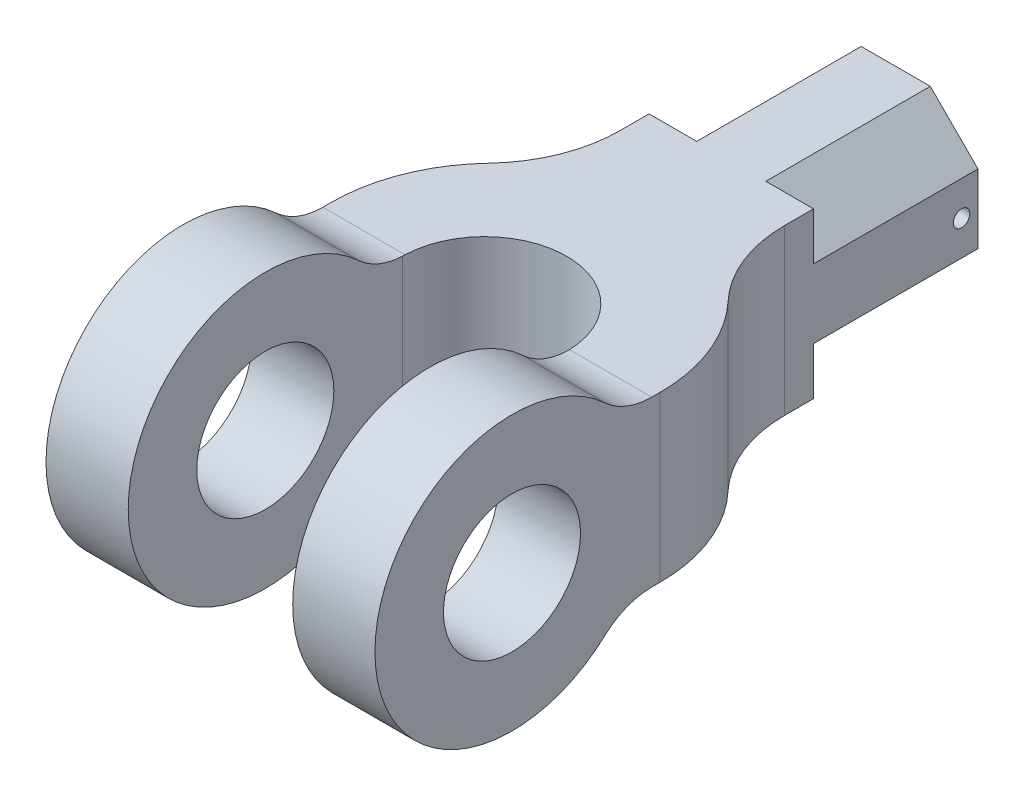
from build123d import *

# Parameters (mm, degrees)
SKETCH1_W           = 1200
SKETCH1_H           = 2500
BOSS_EXTRUDE1_DEPTH = 1000
CUT_EXTRUDE1_DEPTH  = 1000
CUT_EXTRUDE4_DEPTH  = 2948.880594597
CUT_EXTRUDE6_DEPTH  = 600
SKETCH6_R           = 250
CUT_EXTRUDE7_DEPTH  = 120
SKETCH7_R           = 30
CUT_EXTRUDE9_DEPTH  = 2840.013913347
SKETCH8_R           = 250
CUT_EXTRUDE10_DEPTH = 2948.880594722


with BuildPart() as part:
    # Sketch1 → Boss-Extrude1 (new body)
    with BuildSketch(Plane(origin=(0, 0, 0), x_dir=(1, 0, 0), z_dir=(0, 1, 0))):
        with Locations((-600, 1250)):
            Rectangle(SKETCH1_W, SKETCH1_H)
    extrude(amount=BOSS_EXTRUDE1_DEPTH)

    # Sketch2 → Cut-Extrude1 (cut)
    with BuildSketch(Plane(origin=(0, 1000, 0), x_dir=(1, 0, 0), z_dir=(0, 1, 0))):
        with BuildLine():
            Line((-900, 1794.983443527), (-900, 2500))
            Line((-900, 2500), (-1200, 2500))
            Line((-1200, 2500), (-1200, 1040))
            ThreePointArc((-1200, 1040), (-1157.592226371, 1261.564683763), (-1036.363636364, 1451.809151015))
            ThreePointArc((-1036.363636364, 1451.809151015), (-935.339811358, 1610.346207058), (-900, 1794.983443527))
        make_face()
        with BuildLine():
            Line((0, 2500), (-300, 2500))
            Line((-300, 2500), (-300, 1794.983443527))
            ThreePointArc((-300, 1794.983443527), (-264.660188642, 1610.346207058), (-163.636363636, 1451.809151015))
            ThreePointArc((-163.636363636, 1451.809151015), (-42.407773629, 1261.564683763), (0, 1040))
            Line((0, 1040), (0, 2500))
        make_face()
        with BuildLine():
            Line((-600, 0), (-600, 440))
            ThreePointArc((-600, 440), (-755.291427062, 460.444504227), (-900, 520.384757729))
            Line((-900, 520.384757729), (-900, 0))
            Line((-900, 0), (-600, 0))
        make_face()
        with BuildLine():
            Line((-600, 440), (-600, 700))
            ThreePointArc((-600, 700), (-812.132034356, 787.867965644), (-900, 1000))
            Line((-900, 1000), (-900, 520.384757729))
            ThreePointArc((-900, 520.384757729), (-755.291427062, 460.444504227), (-600, 440))
        make_face()
        with BuildLine():
            ThreePointArc((-300, 1000), (-387.867965644, 1212.132034356), (-600, 1300))
            Line((-600, 1300), (-600, 700))
            ThreePointArc((-600, 700), (-387.867965644, 787.867965644), (-300, 1000))
        make_face()
        with BuildLine():
            Line((-600, 700), (-600, 1300))
            ThreePointArc((-600, 1300), (-812.132034356, 1212.132034356), (-900, 1000))
            ThreePointArc((-900, 1000), (-812.132034356, 787.867965644), (-600, 700))
        make_face()
        with BuildLine():
            ThreePointArc((-300, 1000), (-387.867965644, 787.867965644), (-600, 700))
            Line((-600, 700), (-600, 440))
            ThreePointArc((-600, 440), (-444.708572938, 460.444504227), (-300, 520.384757729))
            Line((-300, 520.384757729), (-300, 1000))
        make_face()
        with BuildLine():
            ThreePointArc((-300, 520.384757729), (-444.708572938, 460.444504227), (-600, 440))
            Line((-600, 440), (-600, 0))
            Line((-600, 0), (-300, 0))
            Line((-300, 0), (-300, 520.384757729))
        make_face()
    extrude(amount=-CUT_EXTRUDE1_DEPTH, mode=Mode.SUBTRACT)

    # Sketch3 → Cut-Extrude4 (cut, through all)
    with BuildSketch(Plane(origin=(0, 0, 0), x_dir=(0, 0, -1), z_dir=(1, 0, 0))):
        with BuildLine():
            Line((500, 1000), (0, 1000))
            Line((0, 1000), (0, 499.999997907))
            ThreePointArc((0, 499.999997907), (146.446608667, 853.553389853), (500, 1000))
        make_face()
        with BuildLine():
            Line((1040, 1000), (500, 1000))
            ThreePointArc((500, 1000), (682.574185835, 965.474668126), (839.93463424, 866.666666667))
            ThreePointArc((839.93463424, 866.666666667), (918.614858442, 817.262665937), (1009.901951359, 800))
            Line((1009.901951359, 800), (1040, 800))
            Line((1040, 800), (1040, 1000))
        make_face()
        Polygon((1451.809151015, 1000), (1040, 1000), (1040, 800), (2500, 800), (2500, 1000), (1794.983443527, 1000), align=None)
        Polygon((1040, 200), (1040, 0), (1451.809151015, 0), (1794.983443527, 0), (2500, 0), (2500, 200), align=None)
        with BuildLine():
            ThreePointArc((839.93463424, 133.333333333), (682.574185835, 34.525331874), (500, 0))
            Line((500, 0), (1040, 0))
            Line((1040, 0), (1040, 200))
            Line((1040, 200), (1009.901951359, 200))
            ThreePointArc((1009.901951359, 200), (918.614858442, 182.737334063), (839.93463424, 133.333333333))
        make_face()
        with BuildLine():
            ThreePointArc((500, 0), (146.446610147, 146.446608667), (0, 499.999997907))
            Line((0, 499.999997907), (0, 0))
            Line((0, 0), (500, 0))
        make_face()
    extrude(amount=-CUT_EXTRUDE4_DEPTH, mode=Mode.SUBTRACT)

    # Sketch5 → Cut-Extrude6 (cut)
    with BuildSketch(Plane(origin=(0, 0, -2500), x_dir=(-1, 0, 0), z_dir=(0, 0, -1))):
        Polygon((300, 800), (300, 626), (474, 800), align=None)
        Polygon((900, 800), (813, 713), (900, 626), align=None)
        Polygon((900, 374), (726, 200), (900, 200), align=None)
        Polygon((387, 287), (300, 200), (474, 200), align=None)
        Polygon((300, 374), (300, 200), (387, 287), align=None)
        Polygon((726, 800), (813, 713), (900, 800), align=None)
    extrude(amount=-CUT_EXTRUDE6_DEPTH, mode=Mode.SUBTRACT)

    # Sketch6 → Cut-Extrude7 (cut)
    with BuildSketch(Plane(origin=(0, 0, -2500), x_dir=(-1, 0, 0), z_dir=(0, 0, -1))):
        with Locations((600, 500)):
            Circle(SKETCH6_R)
    extrude(amount=-CUT_EXTRUDE7_DEPTH, mode=Mode.SUBTRACT)

    # Sketch7 → Cut-Extrude9 (cut, through all)
    with BuildSketch(Plane.ZY.offset(900)):
        with Locations((-2440, 500)):
            Circle(SKETCH7_R)
    extrude(amount=-CUT_EXTRUDE9_DEPTH, mode=Mode.SUBTRACT)

    # Sketch8 → Cut-Extrude10 (cut, through all)
    with BuildSketch(Plane(origin=(0, 0, 0), x_dir=(0, 0, -1), z_dir=(1, 0, 0))):
        with Locations((500, 500)):
            Circle(SKETCH8_R)
    extrude(amount=-CUT_EXTRUDE10_DEPTH, mode=Mode.SUBTRACT)


solid = part.part
